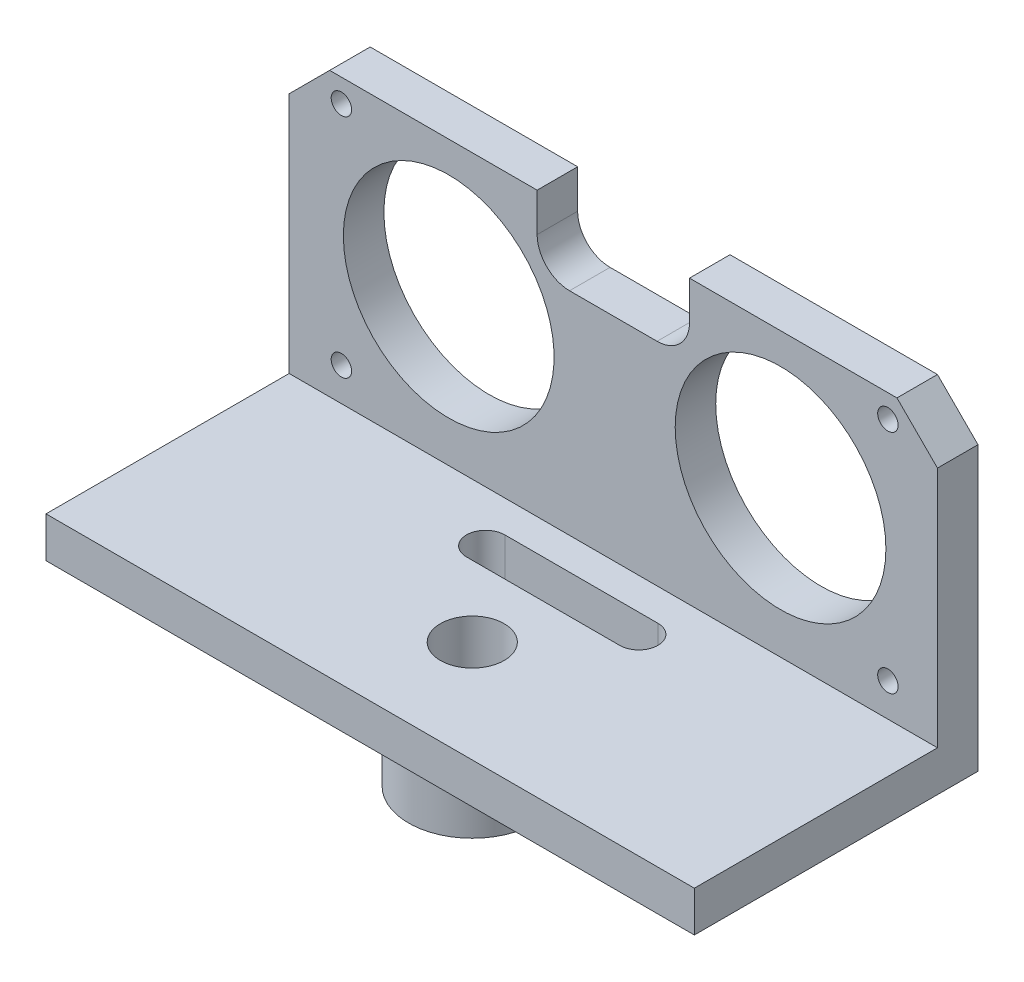
from build123d import *

# Parameters (mm, degrees)
SKETCH1_W                = 50.8
SKETCH1_H                = 34.036
BOSS_EXTRUDE1_DEPTH      = 1.5875
CHAMFER2_SIZE            = 3.175
CUT_EXTRUDE1_DEPTH       = 3.175
SKETCH7_R                = 8.255
CUT_EXTRUDE3_DEPTH       = 3.175
SKETCH8_R                = 8.255
CUT_EXTRUDE4_DEPTH       = 3.175
SKETCH9_R                = 0.8
CUT_EXTRUDE5_DEPTH       = 3.175
SKETCH_1_W               = 50.8
SKETCH_1_H               = 8.7
CUT_EXTRUDE_1_DEPTH      = 10
SKETCH_2_W               = 50.8
SKETCH_2_H               = 3.18
EXTRUDE_1_DEPTH          = 19.05
CUT_EXTRUDE_2_DEPTH      = 10
SKETCH_3_R               = 2.5
CUT_EXTRUDE_3_DEPTH      = 10
SKETCH_5_R               = 5
SKETCH_5_R_2             = 2.5
EXTRUDE_2_DEPTH          = 6.6
CUT_EXTRUDE_4_REACH      = 38.887
CUT_EXTRUDE_4_END_RADIUS = 2.5
SKETCH_6_R               = 1.6
FILLET_1_R               = 1


with BuildPart() as part:
    # Sketch1 → Boss-Extrude1 (new, symmetric)
    with BuildSketch(Plane.XY):
        Rectangle(SKETCH1_W, SKETCH1_H)
    extrude(amount=BOSS_EXTRUDE1_DEPTH, both=True)

    # Chamfer2
    chamfer2_edges = [part.edges().sort_by_distance(p)[0] for p in [
        (-25.4, 17.018, 0),
        (25.4, 17.018, 0),
    ]]
    chamfer(chamfer2_edges, length=CHAMFER2_SIZE)

    # Sketch5 → Cut-Extrude1 (cut)
    with BuildSketch(Plane(origin=(0, 0, -1.5875), x_dir=(-1, 0, 0), z_dir=(0, 0, -1))):
        with BuildLine():
            Line((-5.969, 14.001104381), (-5.969, 17.018))
            Line((-5.969, 17.018), (5.969, 17.018))
            Line((5.969, 17.018), (5.969, 14.001104381))
            ThreePointArc((5.969, 14.001104381), (5.225051224, 12.205053157), (3.429, 11.461104381))
            Line((3.429, 11.461104381), (-3.429, 11.461104381))
            ThreePointArc((-3.429, 11.461104381), (-5.225051224, 12.205053157), (-5.969, 14.001104381))
        make_face()
    extrude(amount=-CUT_EXTRUDE1_DEPTH, mode=Mode.SUBTRACT)

    # Sketch7 → Cut-Extrude3 (cut)
    with BuildSketch(Plane(origin=(0, 0, -1.5875), x_dir=(-1, 0, 0), z_dir=(0, 0, -1))):
        with Locations((12.896, 6.34)):
            Circle(SKETCH7_R)
    extrude(amount=-CUT_EXTRUDE3_DEPTH, mode=Mode.SUBTRACT)

    # Sketch8 → Cut-Extrude4 (cut)
    with BuildSketch(Plane(origin=(0, 0, -1.5875), x_dir=(-1, 0, 0), z_dir=(0, 0, -1))):
        with Locations((-13.104, 6.34)):
            Circle(SKETCH8_R)
    extrude(amount=-CUT_EXTRUDE4_DEPTH, mode=Mode.SUBTRACT)

    # Sketch9 → Cut-Extrude5 (cut)
    with BuildSketch(Plane.XY.offset(1.5875)):
        with Locations((-21.306, 15.21)):
            Circle(SKETCH9_R)
        with Locations((21.514, 15.21)):
            Circle(SKETCH9_R)
        with Locations((21.514, -2.53)):
            Circle(SKETCH9_R)
        with Locations((-21.306, -2.53)):
            Circle(SKETCH9_R)
    extrude(amount=-CUT_EXTRUDE5_DEPTH, mode=Mode.SUBTRACT)

    # 草图1 → 切除-拉伸1 (cut)
    with BuildSketch(Plane.XY.offset(1.5875)):
        with Locations((0, -12.668)):
            Rectangle(SKETCH_1_W, SKETCH_1_H)
    extrude(amount=-CUT_EXTRUDE_1_DEPTH, mode=Mode.SUBTRACT)

    # 草图2 → 凸台-拉伸1 (add)
    with BuildSketch(Plane.XY.offset(1.5875)):
        with Locations((0, -6.728)):
            Rectangle(SKETCH_2_W, SKETCH_2_H)
    extrude(amount=EXTRUDE_1_DEPTH)

    # 草图4 → 切除-拉伸2 (cut)
    with BuildSketch(Plane(origin=(0, -5.138, 0), x_dir=(1, 0, 0), z_dir=(0, 1, 0))):
        with BuildLine():
            Line((-6, -4.0875), (6, -4.0875))
            ThreePointArc((6, -4.0875), (7.5, -5.5875), (6, -7.0875))
            Line((6, -7.0875), (-6, -7.0875))
            ThreePointArc((-6, -7.0875), (-7.5, -5.5875), (-6, -4.0875))
        make_face()
    extrude(amount=-CUT_EXTRUDE_2_DEPTH, mode=Mode.SUBTRACT)

    # 草图3 → 切除-拉伸3 (cut)
    with BuildSketch(Plane(origin=(0, -5.138, 0), x_dir=(1, 0, 0), z_dir=(0, 1, 0))):
        with Locations(Location((0, -12.6375, 0), (0, 0, 270))):
            Circle(SKETCH_3_R)
    extrude(amount=-CUT_EXTRUDE_3_DEPTH, mode=Mode.SUBTRACT)

    # 草图5 → 凸台-拉伸2 (add)
    with BuildSketch(Plane.XZ.offset(8.318)):
        with Locations(Location((0, 12.6375, 0), (0, 0, 270))):
            Circle(SKETCH_5_R)
        with Locations(Location((0, 12.6375, 0), (0, 0, 90))):
            Circle(SKETCH_5_R_2, mode=Mode.SUBTRACT)
    extrude(amount=EXTRUDE_2_DEPTH)

    # 切除-拉伸4: up to this cylinder (the profile starts outside it)
    cut_extrude_4_end = Plane(origin=(0, -11.518, 12.6375), z_dir=(0, 1, 0)) * Cylinder(CUT_EXTRUDE_4_END_RADIUS, 83.774, mode=Mode.PRIVATE)
    # 草图6 → 切除-拉伸4 (cut, up to the surface)
    with BuildSketch(Plane.XY, mode=Mode.PRIVATE) as cut_extrude_4_sk1:
        with Locations(Location((0, -11.518, 0), (0, 0, 180))):
            Circle(SKETCH_6_R)
    cut_extrude_4_tool1 = extrude(cut_extrude_4_sk1.sketch, amount=CUT_EXTRUDE_4_REACH, mode=Mode.PRIVATE) - cut_extrude_4_end
    add(cut_extrude_4_tool1.solids().sort_by_distance((0, -11.518, 0))[0], mode=Mode.SUBTRACT)

    # 圆角1
    fillet_1_edges = [part.edges().sort_by_distance(p)[0] for p in [
        (0, -8.318, 17.6375),
    ]]
    fillet(fillet_1_edges, radius=FILLET_1_R)


solid = part.part
